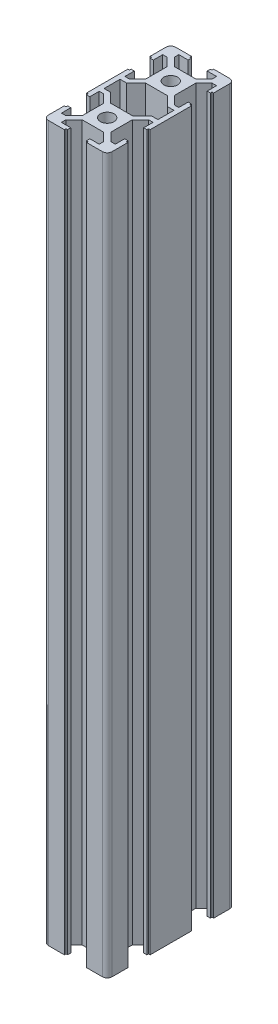
from build123d import *

# Parameters (mm, degrees)
SKETCH22_R                       = 2.15
F_20_SERIES_TS20_40B_5MM_1_DEPTH = 225
M6X1_0_TAPPED_HOLE2_D            = 5
M6X1_0_TAPPED_HOLE2_DEPTH        = 15
M6X1_0_TAPPED_HOLE2_TIP          = 1.502151548


with BuildPart() as part:
    # Sketch22 → 20 series TS20-40B_5MM(1) (new body)
    with BuildSketch(Plane(origin=(0, 0, 0), x_dir=(-1, 0, 0), z_dir=(0, 1, 0))):
        with BuildLine():
            Line((-9.5, 7), (-8.476, 7))
            Line((-8.476, 7), (-8.476, 4.05))
            Line((-8.476, 4.05), (-7.063551759, 4.05))
            Line((-7.063551759, 4.05), (-4.5, 6.613551759))
            Line((-4.5, 6.613551759), (-4.5, 13.386448241))
            Line((-4.5, 13.386448241), (-7.063551759, 15.95))
            Line((-7.063551759, 15.95), (-8.476, 15.95))
            Line((-8.476, 15.95), (-8.476, 13))
            Line((-8.476, 13), (-9.5, 13))
            Line((-9.5, 13), (-9.5, 13.5))
            Line((-9.5, 13.5), (-10, 13.5))
            Line((-10, 13.5), (-10, 18.5014))
            ThreePointArc((-10, 18.5014), (-9.561070222, 19.561070222), (-8.5014, 20))
            Line((-8.5014, 20), (-3.5, 20))
            Line((-3.5, 20), (-3.5, 19.5))
            Line((-3.5, 19.5), (-3, 19.5))
            Line((-3, 19.5), (-3, 18.476))
            Line((-3, 18.476), (-5.95, 18.476))
            Line((-5.95, 18.476), (-5.95, 17.063551759))
            Line((-5.95, 17.063551759), (-3.386448241, 14.5))
            Line((-3.386448241, 14.5), (3.386448241, 14.5))
            Line((3.386448241, 14.5), (5.95, 17.063551759))
            Line((5.95, 17.063551759), (5.95, 18.476))
            Line((5.95, 18.476), (3, 18.476))
            Line((3, 18.476), (3, 19.5))
            Line((3, 19.5), (3.5, 19.5))
            Line((3.5, 19.5), (3.5, 20))
            Line((3.5, 20), (8.5014, 20))
            ThreePointArc((8.5014, 20), (9.561070222, 19.561070222), (10, 18.5014))
            Line((10, 18.5014), (10, 13.5))
            Line((10, 13.5), (9.5, 13.5))
            Line((9.5, 13.5), (9.5, 13))
            Line((9.5, 13), (8.476, 13))
            Line((8.476, 13), (8.476, 15.95))
            Line((8.476, 15.95), (7.063551759, 15.95))
            Line((7.063551759, 15.95), (4.5, 13.386448241))
            Line((4.5, 13.386448241), (4.5, 6.613551759))
            Line((4.5, 6.613551759), (7.063551759, 4.05))
            Line((7.063551759, 4.05), (8.476, 4.05))
            Line((8.476, 4.05), (8.476, 7))
            Line((8.476, 7), (9.5, 7))
            Line((9.5, 7), (9.5, 6.5))
            Line((9.5, 6.5), (10, 6.5))
            Line((10, 6.5), (10, -6.5))
            Line((10, -6.5), (9.5, -6.5))
            Line((9.5, -6.5), (9.5, -7))
            Line((9.5, -7), (8.476, -7))
            Line((8.476, -7), (8.476, -4.05))
            Line((8.476, -4.05), (7.063551759, -4.05))
            Line((7.063551759, -4.05), (4.5, -6.613551759))
            Line((4.5, -6.613551759), (4.5, -13.386448241))
            Line((4.5, -13.386448241), (7.063551759, -15.95))
            Line((7.063551759, -15.95), (8.476, -15.95))
            Line((8.476, -15.95), (8.476, -13))
            Line((8.476, -13), (9.5, -13))
            Line((9.5, -13), (9.5, -13.5))
            Line((9.5, -13.5), (10, -13.5))
            Line((10, -13.5), (10, -18.5014))
            ThreePointArc((10, -18.5014), (9.561070222, -19.561070222), (8.5014, -20))
            Line((8.5014, -20), (3.5, -20))
            Line((3.5, -20), (3.5, -19.5))
            Line((3.5, -19.5), (3, -19.5))
            Line((3, -19.5), (3, -18.476))
            Line((3, -18.476), (5.95, -18.476))
            Line((5.95, -18.476), (5.95, -17.063551759))
            Line((5.95, -17.063551759), (3.386448241, -14.5))
            Line((3.386448241, -14.5), (-3.386448241, -14.5))
            Line((-3.386448241, -14.5), (-5.95, -17.063551759))
            Line((-5.95, -17.063551759), (-5.95, -18.476))
            Line((-5.95, -18.476), (-3, -18.476))
            Line((-3, -18.476), (-3, -19.5))
            Line((-3, -19.5), (-3.5, -19.5))
            Line((-3.5, -19.5), (-3.5, -20))
            Line((-3.5, -20), (-8.5014, -20))
            ThreePointArc((-8.5014, -20), (-9.561070222, -19.561070222), (-10, -18.5014))
            Line((-10, -18.5014), (-10, -13.5))
            Line((-10, -13.5), (-9.5, -13.5))
            Line((-9.5, -13.5), (-9.5, -13))
            Line((-9.5, -13), (-8.476, -13))
            Line((-8.476, -13), (-8.476, -15.95))
            Line((-8.476, -15.95), (-7.063551759, -15.95))
            Line((-7.063551759, -15.95), (-4.5, -13.386448241))
            Line((-4.5, -13.386448241), (-4.5, -6.613551759))
            Line((-4.5, -6.613551759), (-7.063551759, -4.05))
            Line((-7.063551759, -4.05), (-8.476, -4.05))
            Line((-8.476, -4.05), (-8.476, -7))
            Line((-8.476, -7), (-9.5, -7))
            Line((-9.5, -7), (-9.5, -6.5))
            Line((-9.5, -6.5), (-10, -6.5))
            Line((-10, -6.5), (-10, 6.5))
            Line((-10, 6.5), (-9.5, 6.5))
            Line((-9.5, 6.5), (-9.5, 7))
        make_face()
        with Locations((0, 10)):
            Circle(SKETCH22_R, mode=Mode.SUBTRACT)
        with Locations((0, -10)):
            Circle(SKETCH22_R, mode=Mode.SUBTRACT)
        Polygon((-3.45829029, 5.5), (-6.43229029, 2.526), (-8.476, 2.526), (-8.476, -2.526), (-6.43229029, -2.526), (-3.45829029, -5.5), (3.45829029, -5.5), (6.43229029, -2.526), (8.476, -2.526), (8.476, 2.526), (6.43229029, 2.526), (3.45829029, 5.5), align=None, mode=Mode.SUBTRACT)
    extrude(amount=F_20_SERIES_TS20_40B_5MM_1_DEPTH)

    # M6x1.0 Tapped Hole2
    with Locations(Plane(origin=(0, 0, 0), x_dir=(-1, 0, 0), z_dir=(0, -1, 0))):
        with Locations((0, 10), (0, -10)):
            Hole(M6X1_0_TAPPED_HOLE2_D / 2, depth=M6X1_0_TAPPED_HOLE2_DEPTH)
            with Locations((0, 0, -(M6X1_0_TAPPED_HOLE2_DEPTH + M6X1_0_TAPPED_HOLE2_TIP / 2))):  # 118° drill point
                Cone(0, M6X1_0_TAPPED_HOLE2_D / 2, M6X1_0_TAPPED_HOLE2_TIP, mode=Mode.SUBTRACT)


solid = part.part
